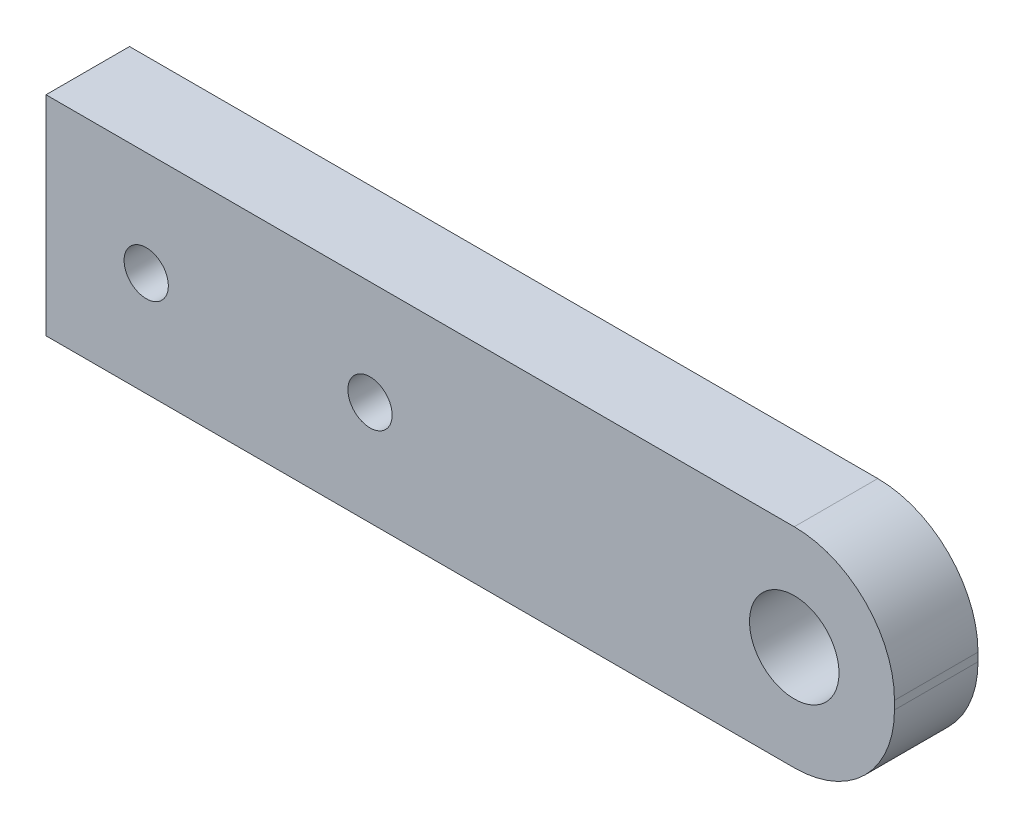
from build123d import *

# Parameters (mm, degrees)
SKETCH1_W           = 101.6
SKETCH1_H           = 25
SKETCH1_R           = 5.3578125
SKETCH1_R_2         = 2.65
BOSS_EXTRUDE1_DEPTH = 10
FILLET1_R           = 12


with BuildPart() as part:
    # Sketch1 → Boss-Extrude1 (new body)
    with BuildSketch(Plane.XY):
        with Locations((63.5, 0)):
            Rectangle(SKETCH1_W, SKETCH1_H)
        with Locations((102.3, 0)):
            Circle(SKETCH1_R, mode=Mode.SUBTRACT)
        with Locations((24.7, 0)):
            Circle(SKETCH1_R_2, mode=Mode.SUBTRACT)
        with Locations((51.5, 0)):
            Circle(SKETCH1_R_2, mode=Mode.SUBTRACT)
    extrude(amount=BOSS_EXTRUDE1_DEPTH)

    # Fillet1
    fillet1_edges = [part.edges().sort_by_distance(p)[0] for p in [
        (114.3, 12.5, 5),
        (114.3, -12.5, 5),
    ]]
    fillet(fillet1_edges, radius=FILLET1_R)


solid = part.part
